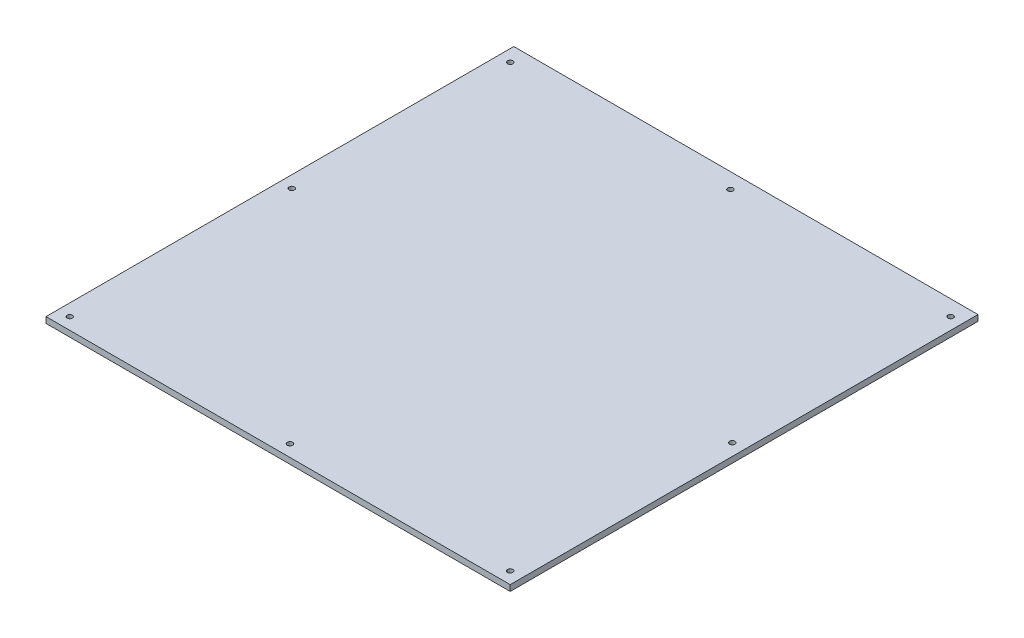
from build123d import *

# Parameters (mm, degrees)
SKETCH_1_W          = 391
SKETCH_1_H          = 394
EXTRUDE_1_DEPTH     = 5
SKETCH_2_R          = 2.25
CUT_EXTRUDE_1_DEPTH = 278.586473013


with BuildPart() as part:
    # 草圖1 → 填料-伸長1 (new body)
    with BuildSketch(Plane(origin=(0, 0, 0), x_dir=(1, 0, 0), z_dir=(0, 1, 0))):
        Rectangle(SKETCH_1_W, SKETCH_1_H)
    extrude(amount=EXTRUDE_1_DEPTH)

    # 草圖2 → 除料-伸長1 (cut, through all)
    with BuildSketch(Plane(origin=(0, 5, 0), x_dir=(1, 0, 0), z_dir=(0, 1, 0))):
        with Locations(Location((-185.5, 184, 0), (0, 0, 270))):
            Circle(SKETCH_2_R)
        with Locations(Location((185.5, 184, 0), (0, 0, 270))):
            Circle(SKETCH_2_R)
        with Locations(Location((-185.5, -187, 0), (0, 0, 270))):
            Circle(SKETCH_2_R)
        with Locations(Location((185.5, -187, 0), (0, 0, 270))):
            Circle(SKETCH_2_R)
        with Locations(Location((185.5, 0, 0), (0, 0, 270))):
            Circle(SKETCH_2_R)
        with Locations(Location((-185.5, 0, 0), (0, 0, 270))):
            Circle(SKETCH_2_R)
        with Locations(Location((0, 184, 0), (0, 0, 270))):
            Circle(SKETCH_2_R)
        with Locations(Location((0, -187, 0), (0, 0, 270))):
            Circle(SKETCH_2_R)
    extrude(amount=-CUT_EXTRUDE_1_DEPTH, mode=Mode.SUBTRACT)


solid = part.part
